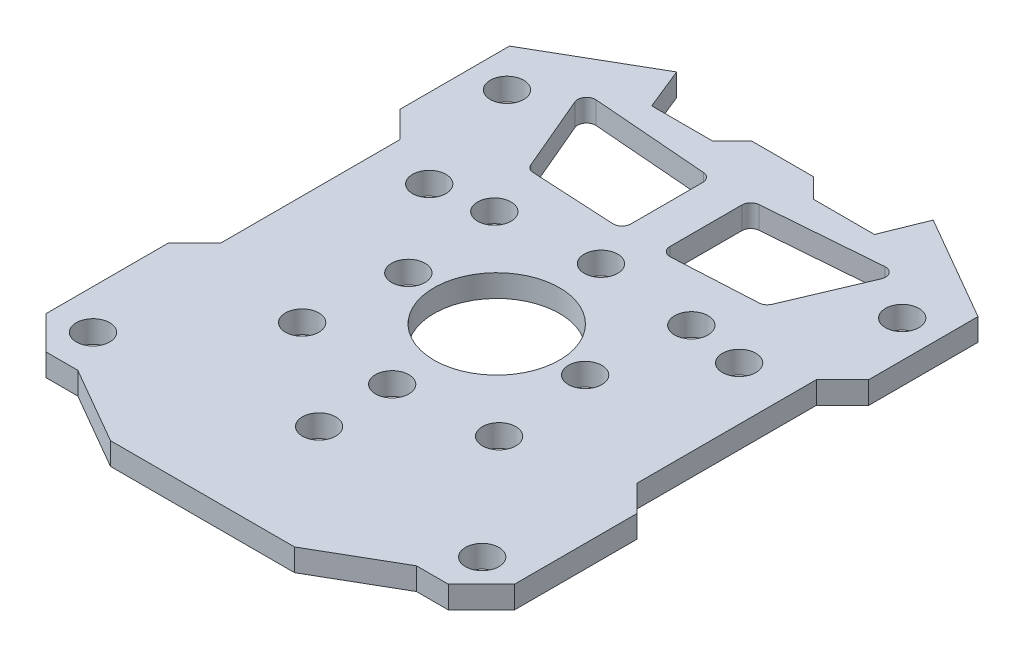
from build123d import *

# Parameters (mm, degrees)
BOSS_EXTRUDE1_DEPTH = 2
SKETCH2_R           = 1.5
SKETCH2_R_2         = 5.625
CUT_EXTRUDE1_DEPTH  = 2
CUT_EXTRUDE2_DEPTH  = 2


with BuildPart() as part:
    # Sketch1 → Boss-Extrude1 (new body)
    with BuildSketch(Plane(origin=(0, 0, 0), x_dir=(1, 0, 0), z_dir=(0, 1, 0))):
        Polygon((2.75, 52), (-2.75, 52), (-4.5, 50.25), (-9.984901653, 50.25), (-11.5, 54), (-21, 48.515172443), (-21, 38.719848481), (-18.65, 36.369848481), (-18.65, 20.319848481), (-21, 17.969848481), (-21, 6.969848481), (-18.030151519, 4), (-15.17820323, 4), (-8.25, 0), (8.25, 0), (15.17820323, 4), (18.030151519, 4), (21, 6.969848481), (21, 17.969848481), (18.65, 20.319848481), (18.65, 36.369848481), (21, 38.719848481), (21, 48.515172443), (11.5, 54), (9.984901653, 50.25), (4.5, 50.25), align=None)
    extrude(amount=BOSS_EXTRUDE1_DEPTH)

    # Sketch2 → Cut-Extrude1 (cut)
    with BuildSketch(Plane(origin=(0, 2, 0), x_dir=(1, 0, 0), z_dir=(0, 1, 0))):
        with Locations(Location((-17.713628621, 45.005868893, 0), (0, 0, 270))):
            Circle(SKETCH2_R)
        with Locations(Location((-17.443074505, 7.627226222, 0), (0, 0, 270))):
            Circle(SKETCH2_R)
        with Locations(Location((0, 10.45, 0), (0, 0, 270))):
            Circle(SKETCH2_R)
        with Locations(Location((0, 17, 0), (0, 0, 270))):
            Circle(SKETCH2_R)
        with Locations(Location((0, 26.375, 0), (0, 0, 270))):
            Circle(SKETCH2_R_2)
        with Locations(Location((-8.82739896, 17.75936, 0), (0, 0, 270))):
            Circle(SKETCH2_R)
        with Locations(Location((-7.925, 26.375, 0), (0, 0, 270))):
            Circle(SKETCH2_R)
        with Locations(Location((-13.890686283, 34.212926204, 0), (0, 0, 270))):
            Circle(SKETCH2_R)
        with Locations(Location((-8.829730603, 34.988250401, 0), (0, 0, 270))):
            Circle(SKETCH2_R)
        with Locations(Location((0, 35.72, 0), (0, 0, 270))):
            Circle(SKETCH2_R)
    cut_extrude1 = extrude(amount=-CUT_EXTRUDE1_DEPTH, mode=Mode.SUBTRACT)

    # Mirror1: Cut-Extrude1 across plane
    add(cut_extrude1.mirror(Plane(origin=(0, 0, 0), x_dir=(0, 0, 1), z_dir=(1, 0, 0))), mode=Mode.SUBTRACT)

    # Sketch3 → Cut-Extrude2 (cut)
    with BuildSketch(Plane(origin=(0, 2, 0), x_dir=(1, 0, 0), z_dir=(0, 1, 0))):
        with BuildLine():
            Line((-2.486814901, 47.397027552), (-12.935032384, 48.224828091))
            ThreePointArc((-12.935032384, 48.224828091), (-13.64734637, 47.894907892), (-13.734631847, 47.114767008))
            Line((-13.734631847, 47.114767008), (-10.820083793, 40.247881869))
            ThreePointArc((-10.820083793, 40.247881869), (-10.542892619, 39.905374095), (-10.126394281, 39.761583775))
            Line((-10.126394281, 39.761583775), (-2.592724852, 39.358665124))
            ThreePointArc((-2.592724852, 39.358665124), (-1.999627345, 39.576928954), (-1.75, 40.157523426))
            Line((-1.75, 40.157523426), (-1.75, 46.599526679))
            ThreePointArc((-1.75, 46.599526679), (-1.962399762, 47.142413371), (-2.486814901, 47.397027552))
        make_face()
        with BuildLine():
            Line((10.126394281, 39.761583775), (2.592724852, 39.358665124))
            ThreePointArc((2.592724852, 39.358665124), (1.999627345, 39.576928954), (1.75, 40.157523426))
            Line((1.75, 40.157523426), (1.75, 46.599526679))
            ThreePointArc((1.75, 46.599526679), (1.962399762, 47.142413371), (2.486814901, 47.397027552))
            Line((2.486814901, 47.397027552), (12.935032384, 48.224828091))
            ThreePointArc((12.935032384, 48.224828091), (13.64734637, 47.894907892), (13.734631847, 47.114767008))
            Line((13.734631847, 47.114767008), (10.820083793, 40.247881869))
            ThreePointArc((10.820083793, 40.247881869), (10.542892619, 39.905374095), (10.126394281, 39.761583775))
        make_face()
    extrude(amount=-CUT_EXTRUDE2_DEPTH, mode=Mode.SUBTRACT)


solid = part.part
